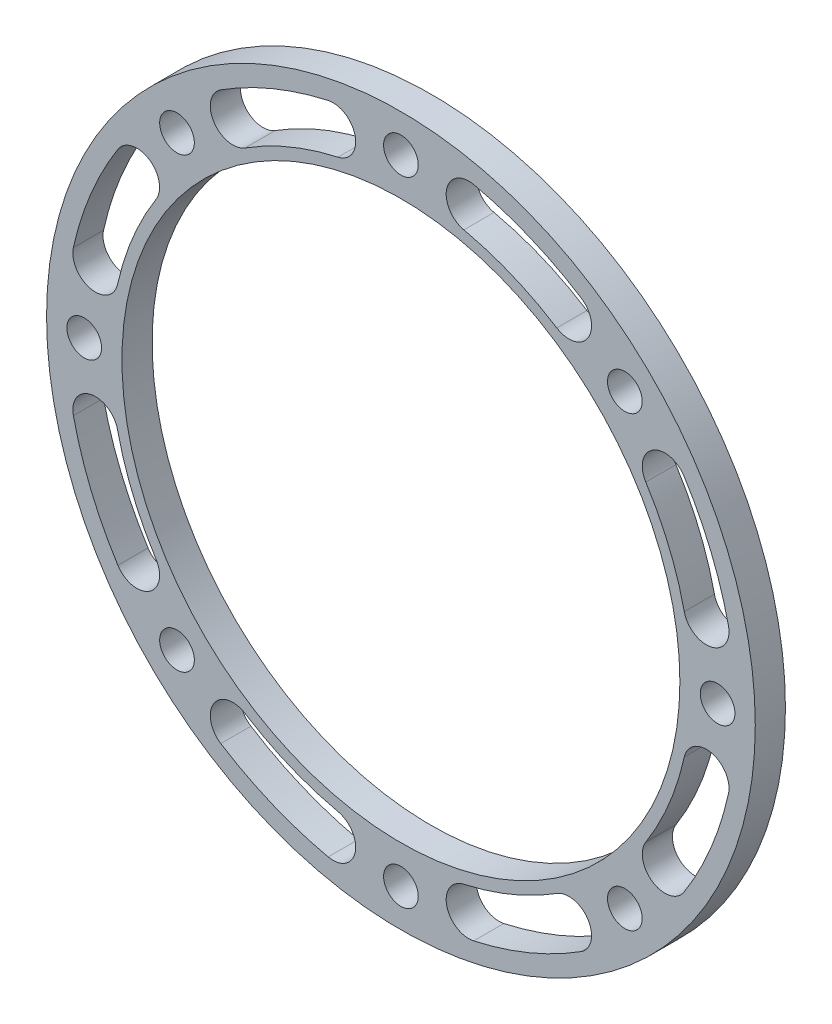
from build123d import *

# Parameters (mm, degrees)
SKETCH_1_R          = 47
SKETCH_1_R_2        = 37
SKETCH_1_R_3        = 2.3
EXTRUDE_1_DEPTH     = 4
CUT_EXTRUDE_1_DEPTH = 67.588287258


with BuildPart() as part:
    # 草图1 → 凸台-拉伸1 (new body)
    with BuildSketch(Plane.XY):
        Circle(SKETCH_1_R)
        Circle(SKETCH_1_R_2, mode=Mode.SUBTRACT)
        with Locations((0, 42)):
            Circle(SKETCH_1_R_3, mode=Mode.SUBTRACT)
        with Locations((29.69848481, 29.69848481)):
            Circle(SKETCH_1_R_3, mode=Mode.SUBTRACT)
        with Locations((42, 0)):
            Circle(SKETCH_1_R_3, mode=Mode.SUBTRACT)
        with Locations((29.69848481, -29.69848481)):
            Circle(SKETCH_1_R_3, mode=Mode.SUBTRACT)
        with Locations((0, -42)):
            Circle(SKETCH_1_R_3, mode=Mode.SUBTRACT)
        with Locations((-29.69848481, -29.69848481)):
            Circle(SKETCH_1_R_3, mode=Mode.SUBTRACT)
        with Locations((-42, 0)):
            Circle(SKETCH_1_R_3, mode=Mode.SUBTRACT)
        with Locations((-29.69848481, 29.69848481)):
            Circle(SKETCH_1_R_3, mode=Mode.SUBTRACT)
    extrude(amount=EXTRUDE_1_DEPTH)

    # 草图3 → 切除-拉伸1 (cut, through all)
    with BuildSketch(Plane.XY.offset(4)):
        with BuildLine():
            ThreePointArc((23.893381773, 37.541394586), (17.02941274, 41.112639197), (9.65060241, 43.440946964))
            ThreePointArc((9.65060241, 43.440946964), (6.071396834, 41.162946208), (8.34939759, 37.583740632))
            ThreePointArc((8.34939759, 37.583740632), (14.733312146, 35.569362002), (20.671802208, 32.479633518))
            ThreePointArc((20.671802208, 32.479633518), (24.813472524, 33.399724269), (23.893381773, 37.541394586))
        make_face()
        with BuildLine():
            ThreePointArc((43.440946964, 9.65060241), (41.112639197, 17.02941274), (37.541394586, 23.893381773))
            ThreePointArc((37.541394586, 23.893381773), (33.399724269, 24.813472524), (32.479633518, 20.671802208))
            ThreePointArc((32.479633518, 20.671802208), (35.569362002, 14.733312146), (37.583740632, 8.34939759))
            ThreePointArc((37.583740632, 8.34939759), (41.162946208, 6.071396834), (43.440946964, 9.65060241))
        make_face()
        with BuildLine():
            ThreePointArc((37.541394586, -23.893381773), (41.112639197, -17.02941274), (43.440946964, -9.65060241))
            ThreePointArc((43.440946964, -9.65060241), (41.162946208, -6.071396834), (37.583740632, -8.34939759))
            ThreePointArc((37.583740632, -8.34939759), (35.569362002, -14.733312146), (32.479633518, -20.671802208))
            ThreePointArc((32.479633518, -20.671802208), (33.399724269, -24.813472524), (37.541394586, -23.893381773))
        make_face()
        with BuildLine():
            ThreePointArc((9.65060241, -43.440946964), (17.02941274, -41.112639197), (23.893381773, -37.541394586))
            ThreePointArc((23.893381773, -37.541394586), (24.813472524, -33.399724269), (20.671802208, -32.479633518))
            ThreePointArc((20.671802208, -32.479633518), (14.733312146, -35.569362002), (8.34939759, -37.583740632))
            ThreePointArc((8.34939759, -37.583740632), (6.071396834, -41.162946208), (9.65060241, -43.440946964))
        make_face()
        with BuildLine():
            ThreePointArc((-23.893381773, -37.541394586), (-17.02941274, -41.112639197), (-9.65060241, -43.440946964))
            ThreePointArc((-9.65060241, -43.440946964), (-6.071396834, -41.162946208), (-8.34939759, -37.583740632))
            ThreePointArc((-8.34939759, -37.583740632), (-14.733312146, -35.569362002), (-20.671802208, -32.479633518))
            ThreePointArc((-20.671802208, -32.479633518), (-24.813472524, -33.399724269), (-23.893381773, -37.541394586))
        make_face()
        with BuildLine():
            ThreePointArc((-43.440946964, -9.65060241), (-41.112639197, -17.02941274), (-37.541394586, -23.893381773))
            ThreePointArc((-37.541394586, -23.893381773), (-33.399724269, -24.813472524), (-32.479633518, -20.671802208))
            ThreePointArc((-32.479633518, -20.671802208), (-35.569362002, -14.733312146), (-37.583740632, -8.34939759))
            ThreePointArc((-37.583740632, -8.34939759), (-41.162946208, -6.071396834), (-43.440946964, -9.65060241))
        make_face()
        with BuildLine():
            ThreePointArc((-37.541394586, 23.893381773), (-41.112639197, 17.02941274), (-43.440946964, 9.65060241))
            ThreePointArc((-43.440946964, 9.65060241), (-41.162946208, 6.071396834), (-37.583740632, 8.34939759))
            ThreePointArc((-37.583740632, 8.34939759), (-35.569362002, 14.733312146), (-32.479633518, 20.671802208))
            ThreePointArc((-32.479633518, 20.671802208), (-33.399724269, 24.813472524), (-37.541394586, 23.893381773))
        make_face()
        with BuildLine():
            ThreePointArc((-9.65060241, 43.440946964), (-17.02941274, 41.112639197), (-23.893381773, 37.541394586))
            ThreePointArc((-23.893381773, 37.541394586), (-24.813472524, 33.399724269), (-20.671802208, 32.479633518))
            ThreePointArc((-20.671802208, 32.479633518), (-14.733312146, 35.569362002), (-8.34939759, 37.583740632))
            ThreePointArc((-8.34939759, 37.583740632), (-6.071396834, 41.162946208), (-9.65060241, 43.440946964))
        make_face()
    extrude(amount=-CUT_EXTRUDE_1_DEPTH, mode=Mode.SUBTRACT)


with BuildPart() as part_1:
    # Move Body 1: moved
    add(part.part.moved(Location((0, 0, -4))))


solid = part_1.part
